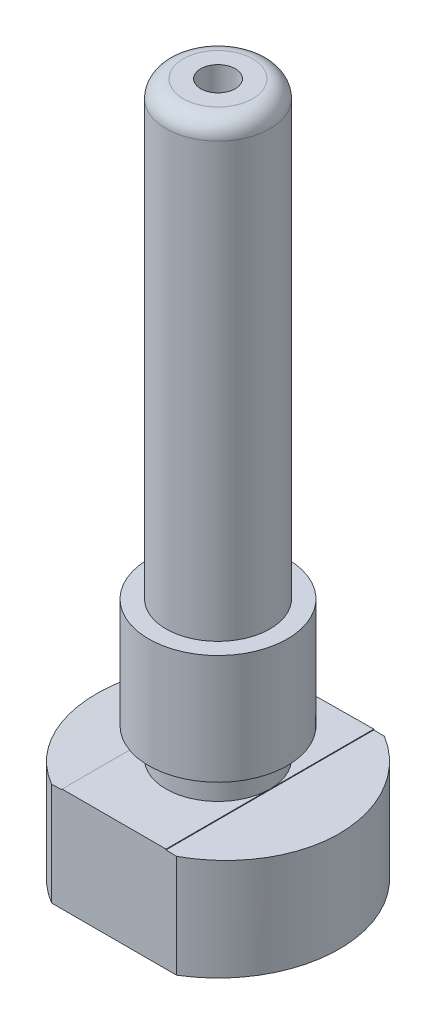
from build123d import *

# Parameters (mm, degrees)
SKETCH2_R                 = 0.5
CUT_EXTRUDE2_DEPTH        = 21.603397778
F_2_0MM_DOWEL_HOLE1_D     = 2
F_2_0MM_DOWEL_HOLE1_DEPTH = 2
F_2_0MM_DOWEL_HOLE1_TIP   = 0.600860619
CUT_EXTRUDE3_DEPTH        = 21.603397778
CUT_EXTRUDE4_DEPTH        = 10


with BuildPart() as part:
    # Sketch1 → Revolve2 (revolve)
    with BuildSketch(Plane.XY, mode=Mode.PRIVATE) as revolve2_sk:
        with BuildLine():
            Line((0, 0), (-3.5, 0))
            Line((-3.5, 0), (-3.5, 3))
            Line((-3.5, 3), (-1.5, 3))
            Line((-1.5, 3), (-1.5, 3.833209081))
            Line((-1.5, 3.833209081), (-2, 3.833209081))
            Line((-2, 3.833209081), (-2, 7))
            Line((-2, 7), (-1.5, 7))
            Line((-1.5, 7), (-1.5, 19.5))
            ThreePointArc((-1.5, 19.5), (-1.353553391, 19.853553391), (-1, 20))
            Line((-1, 20), (0, 20))
            Line((0, 20), (0, 0))
        make_face()
    revolve(revolve2_sk.sketch.rotate(Axis((0, 7, 0), (0, 1, 0)), 270), axis=Axis((0, 7, 0), (0, 1, 0)))

    # Sketch2 → Cut-Extrude2 (cut, through all)
    with BuildSketch(Plane(origin=(0, 20, 0), x_dir=(1, 0, 0), z_dir=(0, 1, 0))):
        with Locations(Location((0, 0, 0), (0, 0, 270))):
            Circle(SKETCH2_R)
    extrude(amount=-CUT_EXTRUDE2_DEPTH, mode=Mode.SUBTRACT)

    # Ø2.0mm Dowel Hole1
    with Locations(Plane(origin=(0, 0, 0), x_dir=(-1, 0, 0), z_dir=(0, -1, 0))):
        with Locations((0, 0)):
            Hole(F_2_0MM_DOWEL_HOLE1_D / 2, depth=F_2_0MM_DOWEL_HOLE1_DEPTH)
            with Locations((0, 0, -(F_2_0MM_DOWEL_HOLE1_DEPTH + F_2_0MM_DOWEL_HOLE1_TIP / 2))):  # 118° drill point
                Cone(0, F_2_0MM_DOWEL_HOLE1_D / 2, F_2_0MM_DOWEL_HOLE1_TIP, mode=Mode.SUBTRACT)

    # Sketch6 → Cut-Extrude3 (cut, through all)
    with BuildSketch(Plane(origin=(0, 20, 0), x_dir=(1, 0, 0), z_dir=(0, 1, 0))):
        with BuildLine():
            Line((1.802775638, -3), (-1.802775638, -3))
            ThreePointArc((-1.802775638, -3), (0, -3.5), (1.802775638, -3))
        make_face()
        with BuildLine():
            Line((-1.861759264, 2.963756475), (1.802775638, 3))
            ThreePointArc((1.802775638, 3), (-0.034614525, 3.499828829), (-1.861759264, 2.963756475))
        make_face()
    extrude(amount=-CUT_EXTRUDE3_DEPTH, mode=Mode.SUBTRACT)

    # Sketch7 → Cut-Extrude4 (cut)
    with BuildSketch(Plane.XY.offset(3)):
        with BuildLine():
            Line((-6.314985728, 2.627394042), (-6.005388139, 3.404344388))
            Line((-6.005388139, 3.404344388), (-1.5, 3.41660454))
            Line((-1.5, 3.41660454), (-1.5, 2.979046191))
            ThreePointArc((-1.5, 2.979046191), (-3.9114467, 2.857357895), (-6.314985728, 2.627394042))
        make_face()
        with BuildLine():
            Line((5.565529025, 2.710812451), (5.565529025, 3.41660454))
            Line((5.565529025, 3.41660454), (1.5, 3.41660454))
            Line((1.5, 3.41660454), (1.5, 2.979046191))
            ThreePointArc((1.5, 2.979046191), (3.535309383, 2.883501076), (5.565529025, 2.710812451))
        make_face()
    extrude(amount=-CUT_EXTRUDE4_DEPTH, mode=Mode.SUBTRACT)


solid = part.part
